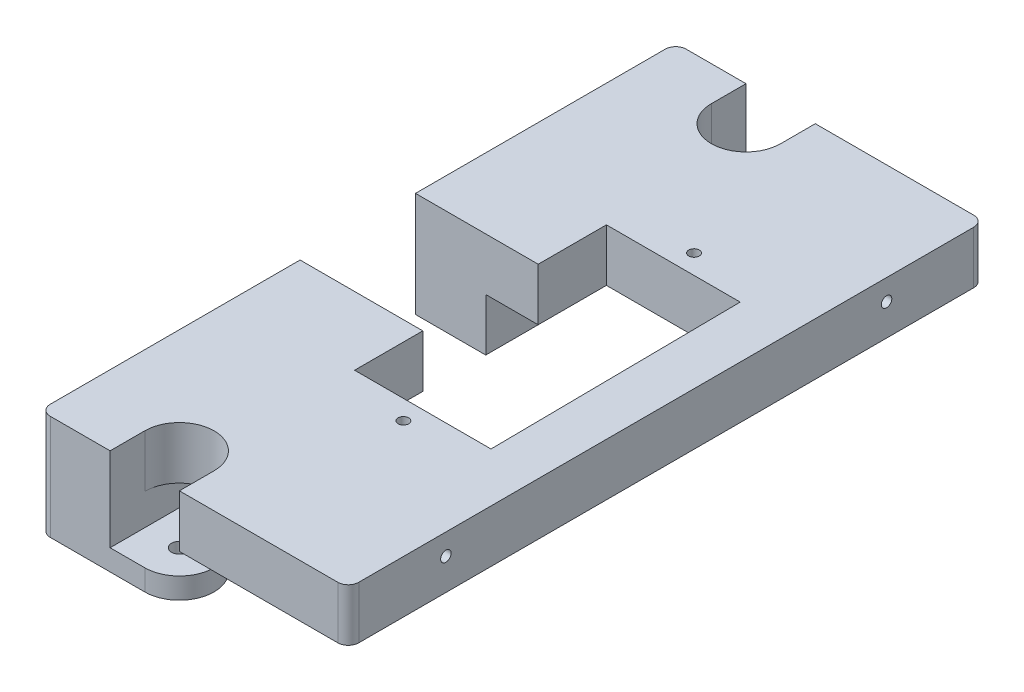
from build123d import *

# Parameters (mm, degrees)
SKETCH_1_R           = 1.5
EXTRUDE_1_DEPTH      = 10
SKETCH_2_W           = 8.63091869
SKETCH_2_H           = 65.296694921
CUT_EXTRUDE_1_DEPTH  = 8
SKETCH_3_W           = 60.606
SKETCH_3_H           = 5
EXTRUDE_2_DEPTH      = 15
CUT_EXTRUDE_2_DEPTH  = 15
CUT_EXTRUDE_3_DEPTH  = 15
SKETCH_7_W           = 6.5
SKETCH_7_H           = 12
CUT_EXTRUDE_4_DEPTH  = 15
EXTRUDE_3_DEPTH      = 7.7
EXTRUDE_3_DEPTH_BACK = 1
SKETCH_8_W           = 60.606
SKETCH_8_H           = 5
CUT_EXTRUDE_5_DEPTH  = 7.7
EXTRUDE_4_DEPTH      = 16
SKETCH_13_R          = 1.5
CUT_EXTRUDE_6_DEPTH  = 10.5
CUT_EXTRUDE_7_DEPTH  = 2
SKETCH_17_W          = 16.187708769
SKETCH_17_H          = 64.99365071
CUT_EXTRUDE_8_DEPTH  = 16
SKETCH_18_R          = 1.5
SKETCH_18_R_2        = 0.5
EXTRUDE_5_DEPTH      = 5
SKETCH_19_R          = 1.5
SKETCH_19_R_2        = 0.75
EXTRUDE_6_DEPTH      = 2
SKETCH_20_W          = 6.697
SKETCH_20_H          = 11
SKETCH_20_W_2        = 2.056917385
CUT_EXTRUDE_9_DEPTH  = 15
CUT_EXTRUDE_10_DEPTH = 10
SKETCH_22_W          = 4
SKETCH_22_H          = 6.5
EXTRUDE_7_DEPTH      = 5
SKETCH_23_R          = 0.5
CUT_EXTRUDE_11_DEPTH = 5
SKETCH_24_R          = 0.5
EXTRUDE_8_DEPTH      = 5


with BuildPart() as part:
    # 草图1 → 凸台-拉伸1 (new body)
    with BuildSketch(Plane(origin=(0, 0, 0), x_dir=(1, 0, 0), z_dir=(0, 1, 0))):
        with BuildLine():
            Line((0, 50.697), (-2.303, 50.697))
            ThreePointArc((-2.303, 50.697), (-3.010106781, 50.404106781), (-3.303, 49.697))
            Line((-3.303, 49.697), (-3.303, 4.303))
            ThreePointArc((-3.303, 4.303), (-3.010106781, 3.595893219), (-2.303, 3.303))
            Line((-2.303, 3.303), (0, 3.303))
            ThreePointArc((0, 3.303), (3.303, 0), (0, -3.303))
            Line((0, -3.303), (-9, -3.303))
            ThreePointArc((-9, -3.303), (-9.707106781, -3.010106781), (-10, -2.303))
            Line((-10, -2.303), (-10, 56.303))
            ThreePointArc((-10, 56.303), (-9.707106781, 57.010106781), (-9, 57.303))
            Line((-9, 57.303), (0, 57.303))
            ThreePointArc((0, 57.303), (3.303, 54), (0, 50.697))
        make_face()
        with Locations(Location((0, 0, 0), (0, 0, 270))):
            Circle(SKETCH_1_R, mode=Mode.SUBTRACT)
        with Locations(Location((0, 54, 0), (0, 0, 270))):
            Circle(SKETCH_1_R, mode=Mode.SUBTRACT)
    extrude(amount=EXTRUDE_1_DEPTH)

    # 草图2 → 切除-拉伸1 (cut)
    with BuildSketch(Plane(origin=(0, 10, 0), x_dir=(1, 0, 0), z_dir=(0, 1, 0))):
        with Locations((1.012459345, 26.901356544)):
            Rectangle(SKETCH_2_W, SKETCH_2_H)
    extrude(amount=-CUT_EXTRUDE_1_DEPTH, mode=Mode.SUBTRACT)

    # 草图3 → 凸台-拉伸2 (add)
    with BuildSketch(Plane(origin=(-3.303, 0, 0), x_dir=(0, 0, -1), z_dir=(1, 0, 0))):
        with Locations((27, 7.5)):
            Rectangle(SKETCH_3_W, SKETCH_3_H)
    extrude(amount=EXTRUDE_2_DEPTH)

    # 草图4 → 切除-拉伸2 (cut)
    with BuildSketch(Plane(origin=(0, 10, 0), x_dir=(1, 0, 0), z_dir=(0, 1, 0))):
        with BuildLine():
            ThreePointArc((10.697, 57.303), (11.404106781, 57.010106781), (11.697, 56.303))
            Line((11.697, 56.303), (11.697, 57.303))
            Line((11.697, 57.303), (10.697, 57.303))
        make_face()
        with BuildLine():
            ThreePointArc((11.697, -2.303), (11.404106781, -3.010106781), (10.697, -3.303))
            Line((10.697, -3.303), (11.697, -3.303))
            Line((11.697, -3.303), (11.697, -2.303))
        make_face()
    extrude(amount=-CUT_EXTRUDE_2_DEPTH, mode=Mode.SUBTRACT)

    # 草图5 → 切除-拉伸3 (cut)
    with BuildSketch(Plane.XZ.offset(-5)):
        with BuildLine():
            Line((-3.303, 3.303), (-3.303, 0))
            ThreePointArc((-3.303, 0), (0, -3.303), (3.303, 0))
            ThreePointArc((3.303, 0), (2.335573698, 2.335573698), (0, 3.303))
            Line((0, 3.303), (-3.303, 3.303))
        make_face()
        with BuildLine():
            ThreePointArc((0, 3.303), (2.335573698, 2.335573698), (3.303, 0))
            Line((3.303, 0), (3.303, 3.303))
            Line((3.303, 3.303), (0, 3.303))
        make_face()
        with BuildLine():
            ThreePointArc((0, -50.697), (-2.335573698, -51.664426302), (-3.303, -54))
            Line((-3.303, -54), (-3.303, -57.303))
            Line((-3.303, -57.303), (0, -57.303))
            ThreePointArc((0, -57.303), (2.335573698, -56.335573698), (3.303, -54))
            ThreePointArc((3.303, -54), (2.335573698, -51.664426302), (0, -50.697))
        make_face()
        with BuildLine():
            ThreePointArc((3.303, -54), (2.335573698, -56.335573698), (0, -57.303))
            Line((0, -57.303), (3.303, -57.303))
            Line((3.303, -57.303), (3.303, -54))
        make_face()
    extrude(amount=-CUT_EXTRUDE_3_DEPTH, mode=Mode.SUBTRACT)

    # 草图7 → 切除-拉伸4 (cut)
    with BuildSketch(Plane(origin=(0, 5, 0), x_dir=(-1, 0, 0), z_dir=(0, -1, 0))):
        with Locations((-0.947, 33)):
            Rectangle(SKETCH_7_W, SKETCH_7_H)
        Polygon((-4.197, 27), (-4.197, 39), (-10.697, 39), (-10.697, 15), (2.303, 15), (2.303, 27), align=None)
    extrude(amount=-CUT_EXTRUDE_4_DEPTH, mode=Mode.SUBTRACT)

    # 草图8 → 凸台-拉伸3 (add, two sides: drawn at the far end of the back side and taken through both)
    with BuildSketch(Plane(origin=(11.697, 0, 0), x_dir=(0, 0, -1), z_dir=(1, 0, 0)).offset(-EXTRUDE_3_DEPTH_BACK)):
        with Locations((27, 7.5)):
            Rectangle(SKETCH_8_W, SKETCH_8_H)
    extrude(amount=EXTRUDE_3_DEPTH + EXTRUDE_3_DEPTH_BACK)

    # 草图10 → 切除-拉伸5 (cut)
    with BuildSketch(Plane(origin=(0, 10, 0), x_dir=(1, 0, 0), z_dir=(0, 1, 0))):
        with BuildLine():
            ThreePointArc((18.397, 57.303), (19.104106781, 57.010106781), (19.397, 56.303))
            Line((19.397, 56.303), (19.397, 57.303))
            Line((19.397, 57.303), (18.397, 57.303))
        make_face()
        with BuildLine():
            ThreePointArc((19.397, -2.303), (19.104106781, -3.010106781), (18.397, -3.303))
            Line((18.397, -3.303), (19.397, -3.303))
            Line((19.397, -3.303), (19.397, -2.303))
        make_face()
    extrude(amount=-CUT_EXTRUDE_5_DEPTH, mode=Mode.SUBTRACT)

    # 草图12 → 凸台-拉伸4 (add)
    with BuildSketch(Plane.XZ.offset(-5)):
        with BuildLine():
            Line((17.397, 2.303), (17.397, -56.303))
            ThreePointArc((17.397, -56.303), (17.689893219, -57.010106781), (18.397, -57.303))
            ThreePointArc((18.397, -57.303), (19.104106781, -57.010106781), (19.397, -56.303))
            Line((19.397, -56.303), (19.397, 2.303))
            ThreePointArc((19.397, 2.303), (19.104106781, 3.010106781), (18.397, 3.303))
            ThreePointArc((18.397, 3.303), (17.689893219, 3.010106781), (17.397, 2.303))
        make_face()
    extrude(amount=EXTRUDE_4_DEPTH)

    # 草图13 → 切除-拉伸6 (cut)
    with BuildSketch(Plane(origin=(0, 10, 0), x_dir=(1, 0, 0), z_dir=(0, 1, 0))):
        with Locations(Location((4.197, 13.15, 0), (0, 0, 270))):
            Circle(SKETCH_13_R)
        with Locations(Location((4.197, 40.85, 0), (0, 0, 270))):
            Circle(SKETCH_13_R)
    extrude(amount=-CUT_EXTRUDE_6_DEPTH, mode=Mode.SUBTRACT)

    # 草图16 → 切除-拉伸7 (cut)
    with BuildSketch(Plane(origin=(19.397, 0, 0), x_dir=(0, 0, -1), z_dir=(1, 0, 0))):
        with BuildLine():
            ThreePointArc((6, 7.5), (6.353553391, 7.646446609), (6.5, 8))
            Line((6.5, 8), (6, 8))
            Line((6, 8), (6, 7.5))
        make_face()
        with BuildLine():
            Line((6, 8), (6.5, 8))
            ThreePointArc((6.5, 8), (5.646446609, 8.353553391), (6, 7.5))
            Line((6, 7.5), (6, 8))
        make_face()
        with BuildLine():
            ThreePointArc((6, -8.5), (5.646446609, -9.353553391), (6.5, -9))
            Line((6.5, -9), (6, -9))
            Line((6, -9), (6, -8.5))
        make_face()
        with BuildLine():
            Line((6, -9), (6.5, -9))
            ThreePointArc((6.5, -9), (6.353553391, -8.646446609), (6, -8.5))
            Line((6, -8.5), (6, -9))
        make_face()
        with BuildLine():
            ThreePointArc((48, -8.5), (47.646446609, -8.646446609), (47.5, -9))
            Line((47.5, -9), (48, -9))
            Line((48, -9), (48, -8.5))
        make_face()
        with BuildLine():
            Line((48, -9), (47.5, -9))
            ThreePointArc((47.5, -9), (48, -9.5), (48.5, -9))
            ThreePointArc((48.5, -9), (48.353553391, -8.646446609), (48, -8.5))
            Line((48, -8.5), (48, -9))
        make_face()
        with BuildLine():
            ThreePointArc((48.5, 8), (48, 8.5), (47.5, 8))
            Line((47.5, 8), (48, 8))
            Line((48, 8), (48, 7.5))
            ThreePointArc((48, 7.5), (48.353553391, 7.646446609), (48.5, 8))
        make_face()
        with BuildLine():
            Line((48, 8), (47.5, 8))
            ThreePointArc((47.5, 8), (47.646446609, 7.646446609), (48, 7.5))
            Line((48, 7.5), (48, 8))
        make_face()
    extrude(amount=-CUT_EXTRUDE_7_DEPTH, mode=Mode.SUBTRACT)

    # 草图17 → 切除-拉伸8 (cut)
    with BuildSketch(Plane.XZ.offset(11)):
        with Locations((22.196549454, -27.767960921)):
            Rectangle(SKETCH_17_W, SKETCH_17_H)
    extrude(amount=-CUT_EXTRUDE_8_DEPTH, mode=Mode.SUBTRACT)

    # 草图18 → 凸台-拉伸5 (add)
    # profile 1 of 2: a face of its own
    with BuildSketch(Plane(origin=(0, 10, 0), x_dir=(1, 0, 0), z_dir=(0, 1, 0))):
        with Locations((4.197, 13.15)):
            Circle(SKETCH_18_R)
        with Locations(Location((4.197, 13.15, 0), (0, 0, 270))):
            Circle(SKETCH_18_R_2, mode=Mode.SUBTRACT)
    # profile 2 of 2: a face of its own
    with BuildSketch(Plane(origin=(0, 10, 0), x_dir=(1, 0, 0), z_dir=(0, 1, 0))):
        with Locations((4.197, 40.85)):
            Circle(SKETCH_18_R)
        with Locations(Location((4.197, 40.85, 0), (0, 0, 270))):
            Circle(SKETCH_18_R_2, mode=Mode.SUBTRACT)
    extrude(amount=-EXTRUDE_5_DEPTH)

    # 草图19 → 凸台-拉伸6 (add)
    # profile 1 of 2: a face of its own
    with BuildSketch(Plane.XZ):
        Circle(SKETCH_19_R)
        with Locations(Location((0, 0, 0), (0, 0, 270))):
            Circle(SKETCH_19_R_2, mode=Mode.SUBTRACT)
    # profile 2 of 2: a face of its own
    with BuildSketch(Plane.XZ):
        with Locations((0, -54)):
            Circle(SKETCH_19_R)
        with Locations(Location((0, -54, 0), (0, 0, 270))):
            Circle(SKETCH_19_R_2, mode=Mode.SUBTRACT)
    extrude(amount=-EXTRUDE_6_DEPTH)

    # 草图20 → 切除-拉伸9 (cut)
    with BuildSketch(Plane(origin=(0, 0, 0), x_dir=(-1, 0, 0), z_dir=(0, -1, 0))):
        with Locations((6.6515, 27)):
            Rectangle(SKETCH_20_W, SKETCH_20_H)
        Polygon((3.303, 32.5), (0, 32.5), (0, 27), (0, 21.5), (3.303, 21.5), align=None)
        with Locations((11.028458692, 27)):
            Rectangle(SKETCH_20_W_2, SKETCH_20_H)
    extrude(amount=-CUT_EXTRUDE_9_DEPTH, mode=Mode.SUBTRACT)

    # 草图21 → 切除-拉伸10 (cut)
    with BuildSketch(Plane(origin=(0, 10, 0), x_dir=(1, 0, 0), z_dir=(0, 1, 0))):
        Polygon((10.697, 15), (14.697, 15), (14.447552493, 39), (10.697, 39), align=None)
    extrude(amount=-CUT_EXTRUDE_10_DEPTH, mode=Mode.SUBTRACT)

    # 草图22 → 凸台-拉伸7 (add)
    with BuildSketch(Plane(origin=(0, 10, 0), x_dir=(1, 0, 0), z_dir=(0, 1, 0))):
        with Locations((-0.303, 18.25)):
            Rectangle(SKETCH_22_W, SKETCH_22_H)
        with Locations((-0.303, 35.75)):
            Rectangle(SKETCH_22_W, SKETCH_22_H)
    extrude(amount=-EXTRUDE_7_DEPTH)

    # 草图23 → 切除-拉伸11 (cut)
    with BuildSketch(Plane(origin=(0, 10, 0), x_dir=(1, 0, 0), z_dir=(0, 1, 0))):
        with Locations(Location((8.197, 13.15, 0), (0, 0, 270))):
            Circle(SKETCH_23_R)
        with Locations(Location((8.197, 40.85, 0), (0, 0, 270))):
            Circle(SKETCH_23_R)
    extrude(amount=-CUT_EXTRUDE_11_DEPTH, mode=Mode.SUBTRACT)

    # 草图24 → 凸台-拉伸8 (add)
    with BuildSketch(Plane(origin=(0, 10, 0), x_dir=(1, 0, 0), z_dir=(0, 1, 0))):
        with Locations((4.197, 13.15)):
            Circle(SKETCH_24_R)
        with Locations((4.197, 40.85)):
            Circle(SKETCH_24_R)
    extrude(amount=-EXTRUDE_8_DEPTH)


solid = part.part
